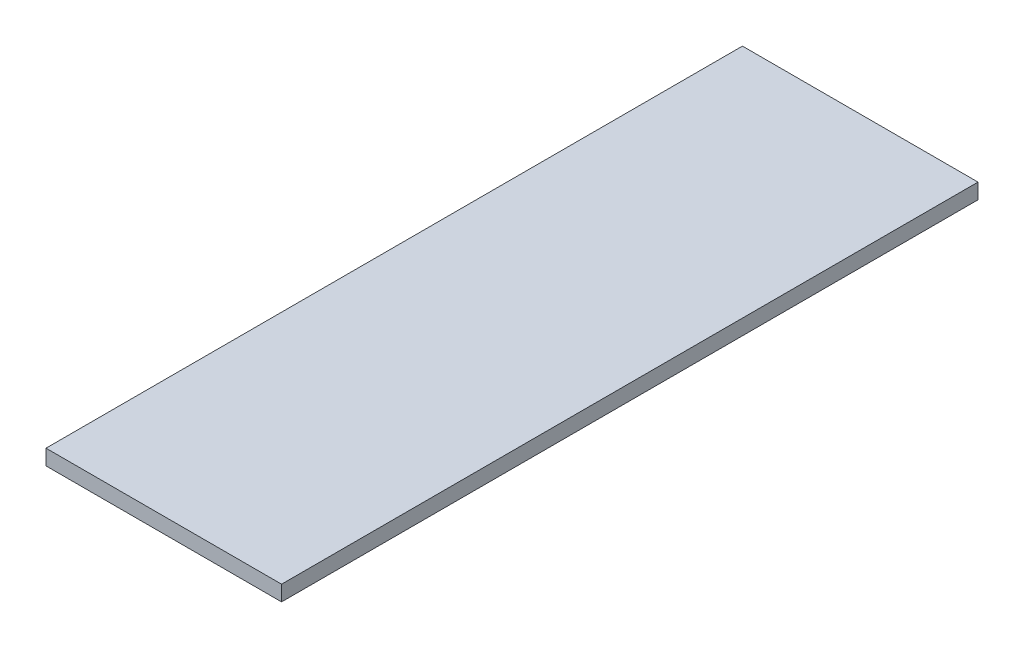
from build123d import *

# Parameters (mm, degrees)
SKETCH1_W           = 11.5
SKETCH1_H           = 34
BOSS_EXTRUDE1_DEPTH = 0.75
SCALE1_SCALE        = 10


with BuildPart() as part:
    # Sketch1 → Boss-Extrude1 (new body)
    with BuildSketch(Plane(origin=(0, 0, 0), x_dir=(1, 0, 0), z_dir=(0, 1, 0))):
        with Locations((-56.172239264, -23.495858896)):
            Rectangle(SKETCH1_W, SKETCH1_H)
    extrude(amount=BOSS_EXTRUDE1_DEPTH)


with BuildPart() as part_1:
    # Scale1: scaled about (-56.172239264, 0.375, 23.495858896)
    add(part.part.scale(SCALE1_SCALE).moved(Location((505.550153376, -3.375, -211.462730064))))


solid = part_1.part
